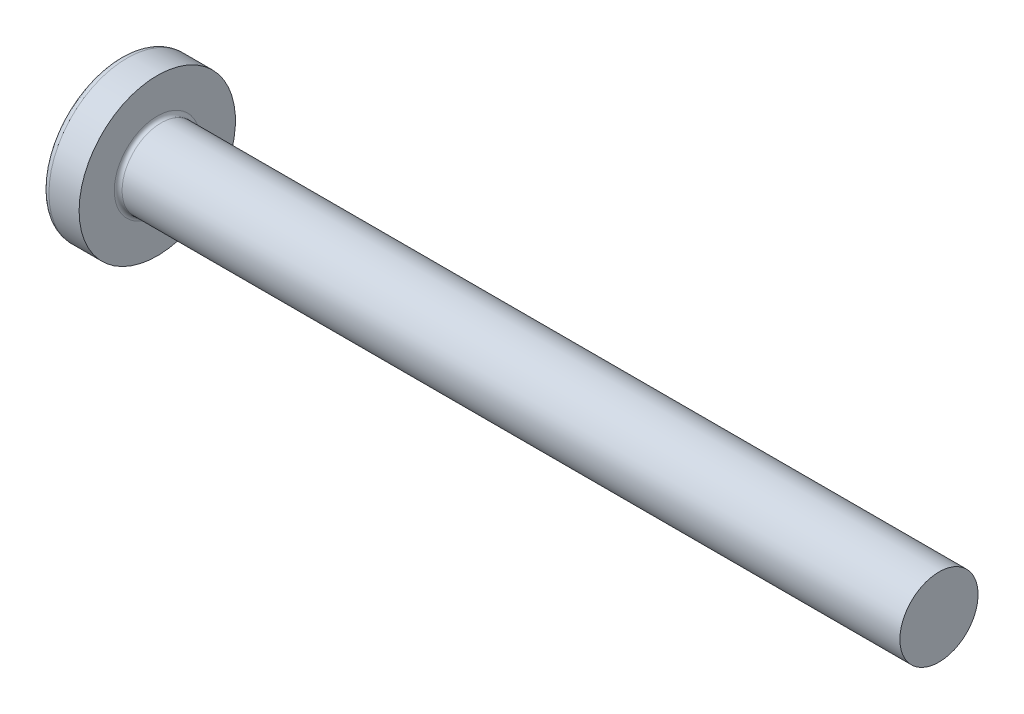
from build123d import *

# Parameters (mm, degrees)
FILLET1_R    = 0.2
RECPAT_COUNT = 2
RECPAT_ANGLE = 90


with BuildPart() as part:
    # BodySke → Base-Revolve (revolve)
    with BuildSketch(Plane.XY, mode=Mode.PRIVATE) as base_revolve_sk:
        with BuildLine():
            Line((3.1, 2), (3.1, 4))
            Line((3.1, 4), (1.555305874, 4))
            ThreePointArc((1.555305874, 4), (1.392873227, 3.961271902), (1.265388955, 3.853420195))
            ThreePointArc((1.265388955, 3.853420195), (0.324444487, 2.027933456), (0, 0))
            Line((0, 0), (43.1, 0))
            Line((43.1, 0), (43.1, 2))
            Line((43.1, 2), (3.1, 2))
        make_face()
    revolve(base_revolve_sk.sketch.rotate(Axis((1.555305874, 0, 0), (1, 0, 0)), 90), axis=Axis((1.555305874, 0, 0), (1, 0, 0)))

    # Fillet1
    fillet1_edges = [part.edges().sort_by_distance(p)[0] for p in [
        (3.1, 0, -2),
    ]]
    fillet(fillet1_edges, radius=FILLET1_R)

    # Sketch3 → Recess section 0
    with BuildSketch(Plane(origin=(0, 0, 0), x_dir=(0, 0, -1), z_dir=(1, 0, 0))):
        with BuildLine():
            Line((0.515, -2.15), (-0.515, -2.15))
            Line((-0.515, -2.15), (-0.515, 2.15))
            Line((-0.515, 2.15), (0.515, 2.15))
            Line((0.515, 2.15), (0.515, -2.15))
        make_face()
    # Sketch4 → Recess section 1
    with BuildSketch(Plane(origin=(2.34, 0, 0), x_dir=(0, 0, -1), z_dir=(1, 0, 0))):
        with BuildLine():
            Line((0.515, -0.983319232), (-0.515, -0.983319232))
            Line((-0.515, -0.983319232), (-0.515, 0.983319232))
            Line((-0.515, 0.983319232), (0.515, 0.983319232))
            Line((0.515, 0.983319232), (0.515, -0.983319232))
        make_face()
    recess = loft(mode=Mode.SUBTRACT)

    # RecPat: Recess ×2 about axis
    recpat_axis = Axis((0, 0, 0), (1, 0, 0))
    for i in range(1, RECPAT_COUNT):
        add(recess.rotate(recpat_axis, i * RECPAT_ANGLE / (RECPAT_COUNT - 1)), mode=Mode.SUBTRACT)

    # RecCorSke → RecessCore (revolve, cut)
    with BuildSketch(Plane.XY, mode=Mode.PRIVATE) as recesscore_sk:
        Polygon((0, 0), (0, 1.01462874), (2.34, 0.851), (2.616506661, 0), align=None)
    revolve(recesscore_sk.sketch.rotate(Axis((-3.175, 0, 0), (1, 0, 0)), 14.547591759), axis=Axis((-3.175, 0, 0), (1, 0, 0)), mode=Mode.SUBTRACT)


solid = part.part
